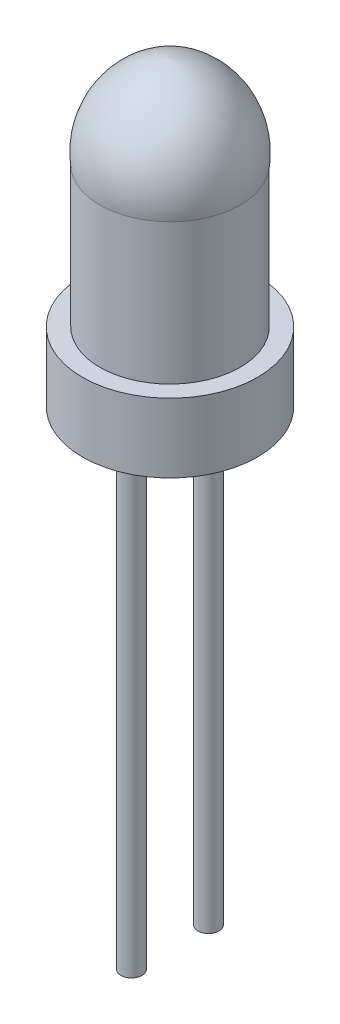
from build123d import *

# Parameters (mm, degrees)
SKETCH2_R           = 0.225118876
BOSS_EXTRUDE1_DEPTH = 10


with BuildPart() as part:
    # Sketch1 → Revolve1 (revolve)
    with BuildSketch(Plane.XY, mode=Mode.PRIVATE) as revolve1_sk:
        with BuildLine():
            Line((0, 0), (0, 6.422564509))
            ThreePointArc((0, 6.422564509), (1.15329097, 5.759594151), (1.5, 4.47530345))
            Line((1.5, 4.47530345), (1.5, 1.47530345))
            Line((1.5, 1.47530345), (1.87, 1.47530345))
            Line((1.87, 1.47530345), (1.87, 0))
            Line((1.87, 0), (0, 0))
        make_face()
    revolve(revolve1_sk.sketch.rotate(Axis((0, 0, 0), (0, 1, 0)), 90), axis=Axis((0, 0, 0), (0, 1, 0)))

    # Sketch2 → Boss-Extrude1 (add)
    with BuildSketch(Plane(origin=(0, 0, 0), x_dir=(-1, 0, 0), z_dir=(0, -1, 0))):
        with Locations(Location((0, 0.822285039, 0), (0, 0, 90))):
            Circle(SKETCH2_R)
        with Locations(Location((0, -0.822285039, 0), (0, 0, 270))):
            Circle(SKETCH2_R)
    extrude(amount=BOSS_EXTRUDE1_DEPTH)


solid = part.part
